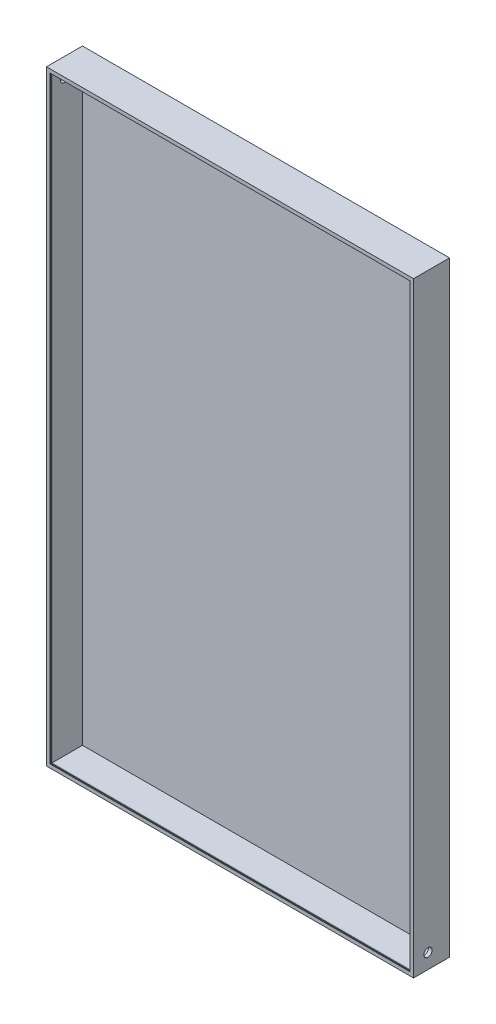
from build123d import *

# Parameters (mm, degrees)
SKETCH1_W           = 1000
SKETCH1_H           = 1662.9
BOSS_EXTRUDE1_DEPTH = 10
SKETCH2_W           = 1020
SKETCH2_H           = 1682.9
SKETCH2_W_2         = 1000
SKETCH2_H_2         = 1662.9
BOSS_EXTRUDE2_DEPTH = 100
CUT_EXTRUDE1_REACH  = 1963.885
SKETCH3_R           = 11.45
SKETCH4_R           = 11.45
CUT_EXTRUDE2_DEPTH  = 10
SKETCH6_W           = 1000
SKETCH6_H           = 1662.9
SKETCH6_W_2         = 996
SKETCH6_H_2         = 1658.9
BOSS_EXTRUDE4_DEPTH = 2


with BuildPart() as part:
    # Sketch1 → Boss-Extrude1 (new body)
    with BuildSketch(Plane.XY):
        with Locations((500, 831.45)):
            Rectangle(SKETCH1_W, SKETCH1_H)
    extrude(amount=BOSS_EXTRUDE1_DEPTH)

    # Sketch2 → Boss-Extrude2 (add)
    with BuildSketch(Plane.XY):
        with Locations((500, 831.45)):
            Rectangle(SKETCH2_W, SKETCH2_H)
        with Locations((500, 831.45)):
            Rectangle(SKETCH2_W_2, SKETCH2_H_2, mode=Mode.SUBTRACT)
    extrude(amount=BOSS_EXTRUDE2_DEPTH)

    # Sketch3 → Cut-Extrude1 (cut, up to next)
    with BuildSketch(Plane.ZY.offset(10), mode=Mode.PRIVATE) as cut_extrude1_sk1:
        with Locations(Location((60, 1631.45, 0), (0, 0, 270))):
            Circle(SKETCH3_R)
    cut_extrude1_tool1 = extrude(cut_extrude1_sk1.sketch, amount=-CUT_EXTRUDE1_REACH, mode=Mode.PRIVATE) & part.part
    add(cut_extrude1_tool1.solids().sort_by_distance((-10, 1631.45, 60))[0], mode=Mode.SUBTRACT)

    # Sketch4 → Cut-Extrude2 (cut)
    with BuildSketch(Plane(origin=(1010, 0, 0), x_dir=(0, 0, -1), z_dir=(1, 0, 0))):
        with Locations(Location((-60, 31.47, 0), (0, 0, 90))):
            Circle(SKETCH4_R)
    extrude(amount=-CUT_EXTRUDE2_DEPTH, mode=Mode.SUBTRACT)

    # Sketch6 → Boss-Extrude4 (add)
    with BuildSketch(Plane.XY.offset(98)):
        with Locations((500, 831.45)):
            Rectangle(SKETCH6_W, SKETCH6_H)
        with Locations((500, 831.45)):
            Rectangle(SKETCH6_W_2, SKETCH6_H_2, mode=Mode.SUBTRACT)
    extrude(amount=-BOSS_EXTRUDE4_DEPTH)


solid = part.part
